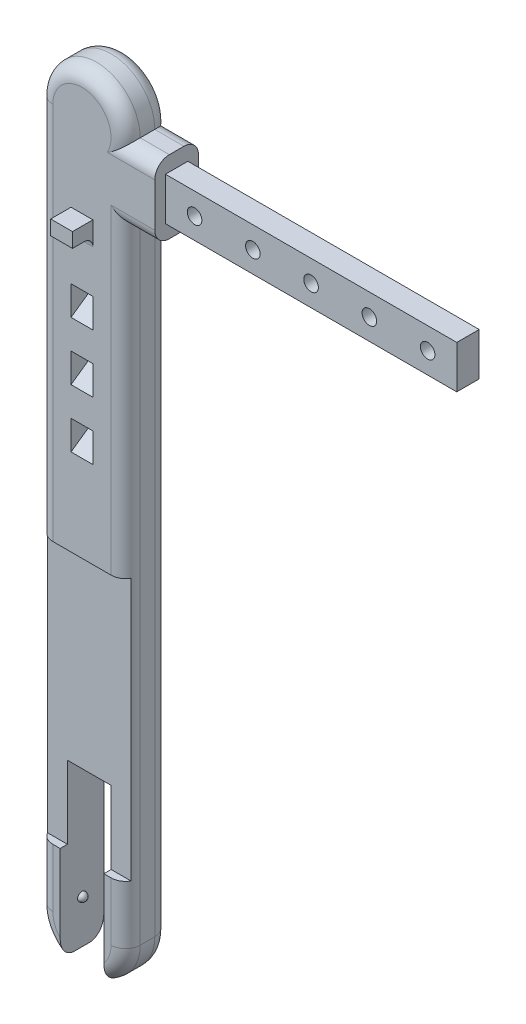
from build123d import *

# Parameters (mm, degrees)
BOSS_EXTRUDE1_DEPTH = 7.5
FILLET1_R           = 5
SKETCH2_W           = 7.7
SKETCH2_H           = 14.7
BOSS_EXTRUDE2_DEPTH = 100
SKETCH3_R           = 2.5
CUT_EXTRUDE1_DEPTH  = 100
SKETCH4_W           = 15
SKETCH4_H           = 60
CUT_EXTRUDE2_DEPTH  = 100
CUT_EXTRUDE3_DEPTH  = 3.75
BOSS_EXTRUDE3_DEPTH = 3.75
SKETCH10_W          = 2.5
SKETCH10_H          = 90
CUT_EXTRUDE4_DEPTH  = 199.475521198


with BuildPart() as part:
    # Sketch1 → Boss-Extrude1 (new, symmetric)
    with BuildSketch(Plane.XY):
        with BuildLine():
            Line((15, 99.936708861), (15, -115.063291139))
            ThreePointArc((15, -115.063291139), (0, -130.063291139), (-15, -115.063291139))
            Line((-15, -115.063291139), (-15, 124.936708861))
            ThreePointArc((-15, 124.936708861), (0, 139.936708861), (15, 124.936708861))
            Line((15, 124.936708861), (25, 124.936708861))
            Line((25, 124.936708861), (25, 99.936708861))
            Line((25, 99.936708861), (15, 99.936708861))
        make_face()
    extrude(amount=BOSS_EXTRUDE1_DEPTH, both=True)

    # Fillet1
    fillet1_edges = [part.edges().sort_by_distance(p)[0] for p in [
        (0, 139.936708861, -7.5),
        (0, -130.063291139, 7.5),
        (15, -7.563291139, 7.5),
        (20, 99.936708861, 7.5),
        (20, 124.936708861, 7.5),
        (0, 139.936708861, 7.5),
        (20, 124.936708861, -7.5),
        (20, 99.936708861, -7.5),
        (15, -7.563291139, -7.5),
        (-15, 4.936708861, 7.5),
        (0, -130.063291139, -7.5),
        (-15, 4.936708861, -7.5),
    ]]
    fillet(fillet1_edges, radius=FILLET1_R)

    # Sketch2 → Boss-Extrude2 (add)
    with BuildSketch(Plane(origin=(25, 0, 0), x_dir=(0, 0, -1), z_dir=(1, 0, 0))):
        with Locations((0, 112.436708861)):
            Rectangle(SKETCH2_W, SKETCH2_H)
    extrude(amount=BOSS_EXTRUDE2_DEPTH)

    # Sketch3 → Cut-Extrude1 (cut)
    with BuildSketch(Plane.XY.offset(3.85)):
        with Locations((35, 112.336708861)):
            Circle(SKETCH3_R)
        with Locations((55, 112.336708861)):
            Circle(SKETCH3_R)
        with Locations((75, 112.336708861)):
            Circle(SKETCH3_R)
        with Locations((95, 112.336708861)):
            Circle(SKETCH3_R)
        with Locations((115, 112.336708861)):
            Circle(SKETCH3_R)
    extrude(amount=-CUT_EXTRUDE1_DEPTH, mode=Mode.SUBTRACT)

    # Sketch4 → Cut-Extrude2 (cut)
    with BuildSketch(Plane.XY.offset(7.5)):
        with Locations((0, -100.063291139)):
            Rectangle(SKETCH4_W, SKETCH4_H)
    extrude(amount=-CUT_EXTRUDE2_DEPTH, mode=Mode.SUBTRACT)

    # Sketch7 → Cut-Extrude3 (cut, symmetric)
    with BuildSketch(Plane(origin=(0, 0, 0), x_dir=(0, 0, -1), z_dir=(1, 0, 0))):
        Polygon((0, 69.936708861), (-7.5, 64.685152324), (-7.5, 74.685152324), (0, 79.936708861), align=None)
        Polygon((0, 49.936708861), (0, 59.936708861), (-7.5, 54.685152324), (-7.5, 44.685152324), align=None)
        Polygon((0, 29.936708861), (0, 39.936708861), (-7.5, 34.685152324), (-7.5, 24.685152324), align=None)
    extrude(amount=CUT_EXTRUDE3_DEPTH, both=True, mode=Mode.SUBTRACT)

    # Sketch8 → Revolve1 (revolve)
    with BuildSketch(Plane.XY):
        with BuildLine():
            Line((-7.5, -113.063291139), (-6, -113.063291139))
            ThreePointArc((-6, -113.063291139), (-6.439339828, -112.002630967), (-7.5, -111.563291139))
            Line((-7.5, -111.563291139), (-7.5, -113.063291139))
        make_face()
        with BuildLine():
            Line((7.5, -113.063291139), (6, -113.063291139))
            ThreePointArc((6, -113.063291139), (6.439339828, -112.002630967), (7.5, -111.563291139))
            Line((7.5, -111.563291139), (7.5, -113.063291139))
        make_face()
    revolve(axis=Axis((-28.138828416, -113.063291139, 0), (1, 0, 0)))

    # Sketch9 → Boss-Extrude3 (add, symmetric)
    with BuildSketch(Plane(origin=(0, 0, 0), x_dir=(0, 0, -1), z_dir=(1, 0, 0))):
        with BuildLine():
            Line((-7.5, 89.436708861), (-7.5, 97.436708861))
            Line((-7.5, 97.436708861), (-14.5, 97.436708861))
            Line((-14.5, 97.436708861), (-14.5, 92.436708861))
            Line((-14.5, 92.436708861), (-10.5, 92.436708861))
            ThreePointArc((-10.5, 92.436708861), (-8.378679656, 91.558029204), (-7.5, 89.436708861))
        make_face()
    extrude(amount=BOSS_EXTRUDE3_DEPTH, both=True)

    # Sketch10 → Cut-Extrude4 (cut, through all)
    with BuildSketch(Plane.ZY.offset(15)):
        with Locations((6.25, -50.063291139)):
            Rectangle(SKETCH10_W, SKETCH10_H)
    extrude(amount=-CUT_EXTRUDE4_DEPTH, mode=Mode.SUBTRACT)


solid = part.part
